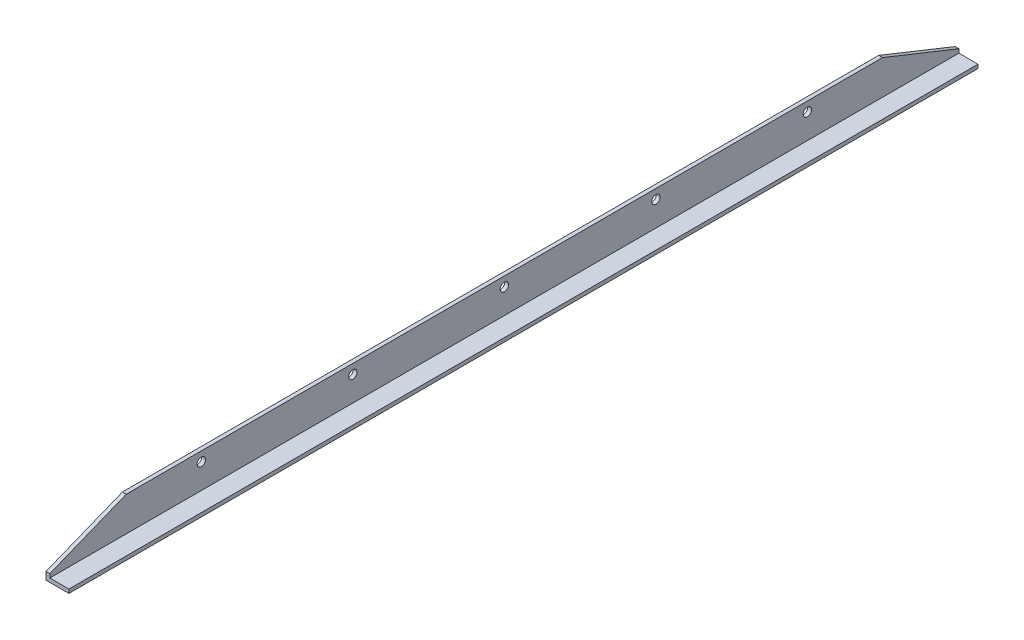
from build123d import *

# Parameters (mm, degrees)
EXTRUDE_THIN1_DEPTH         = 1511.3
F_1_2_CLEARANCE_HOLE1_D     = 13.89126
F_1_2_CLEARANCE_HOLE1_DEPTH = 16.51
F_1_2_CLEARANCE_HOLE1_TIP   = 4.173355541
CUT_EXTRUDE1_DEPTH          = 6.35


with BuildPart() as part:
    # Sketch1 → Extrude-Thin1 (new body)
    with BuildSketch(Plane.XY):
        Polygon((0, 63.5), (0, 0), (38.1, 0), (38.1, 6.35), (6.35, 6.35), (6.35, 63.5), align=None)
    extrude(amount=EXTRUDE_THIN1_DEPTH)

    # 1/2 Clearance Hole1
    with Locations(Plane.ZY):
        with Locations((1259.416666667, 47.625), (1007.533333333, 47.625), (755.65, 47.625), (503.766666667, 47.625), (251.883333333, 47.625)):
            Hole(F_1_2_CLEARANCE_HOLE1_D / 2, depth=F_1_2_CLEARANCE_HOLE1_DEPTH)
            with Locations((0, 0, -(F_1_2_CLEARANCE_HOLE1_DEPTH + F_1_2_CLEARANCE_HOLE1_TIP / 2))):  # 118° drill point
                Cone(0, F_1_2_CLEARANCE_HOLE1_D / 2, F_1_2_CLEARANCE_HOLE1_TIP, mode=Mode.SUBTRACT)

    # Sketch4 → Cut-Extrude1 (cut)
    with BuildSketch(Plane.ZY):
        Polygon((1511.3, 12.7), (1384.3, 63.5), (1511.3, 63.5), align=None)
        Polygon((127, 63.5), (0, 12.7), (0, 63.5), align=None)
    extrude(amount=-CUT_EXTRUDE1_DEPTH, mode=Mode.SUBTRACT)


solid = part.part
